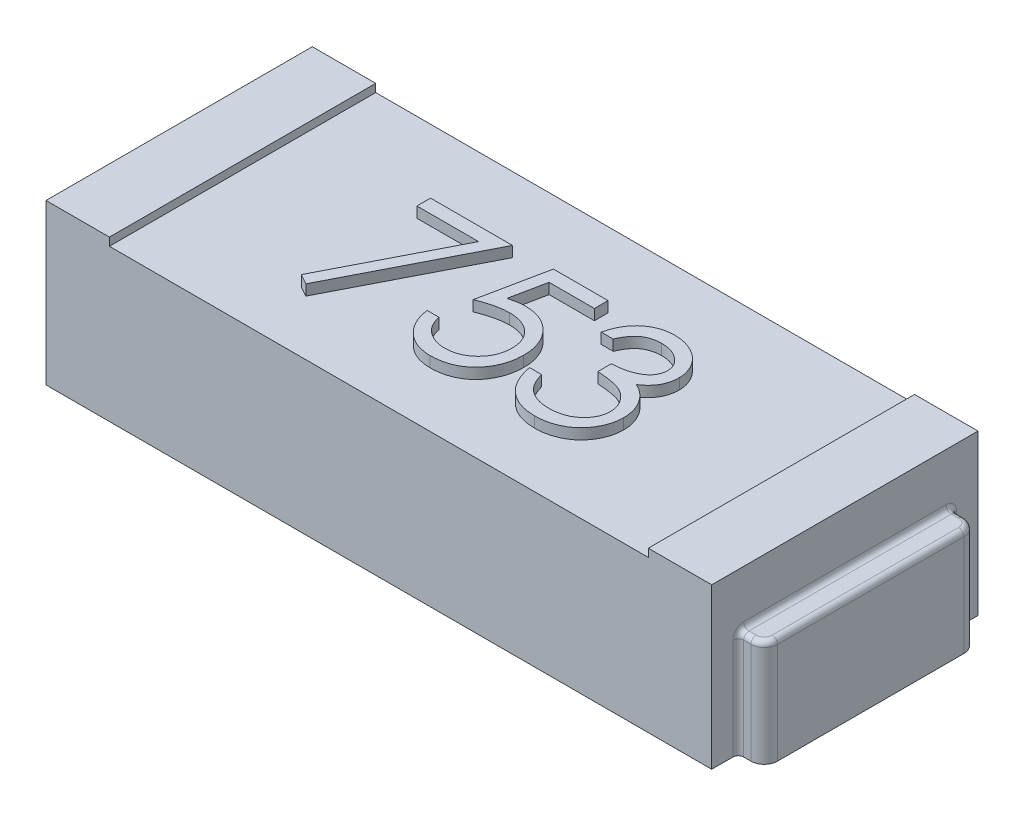
from build123d import *

# Parameters (mm, degrees)
ESQUISSE1_W             = 2.5
ESQUISSE1_H             = 1
BOSS_EXTRU_1_DEPTH      = 0.6
ESQUISSE2_W             = 2.023603034
ESQUISSE2_H             = 1
ENL_V_MAT_EXTRU_1_DEPTH = 0.03
BOSS_EXTRU_2_DEPTH      = 0.4
CONG_1_R                = 0.02
CONG_1_OF_SYM_TRIE2_R   = 0.02
BOSS_EXTRU_3_DEPTH      = 0.04


with BuildPart() as part:
    # Esquisse1 → Boss.-Extru.1 (new body)
    with BuildSketch(Plane(origin=(0, 0, 0), x_dir=(1, 0, 0), z_dir=(0, 1, 0))):
        Rectangle(ESQUISSE1_W, ESQUISSE1_H)
    extrude(amount=BOSS_EXTRU_1_DEPTH)

    # Esquisse2 → Enlèv. mat.-Extru.1 (cut)
    with BuildSketch(Plane(origin=(0, 0.6, 0), x_dir=(1, 0, 0), z_dir=(0, 1, 0))):
        Rectangle(ESQUISSE2_W, ESQUISSE2_H)
    extrude(amount=-ENL_V_MAT_EXTRU_1_DEPTH, mode=Mode.SUBTRACT)

    # Esquisse3 → Boss.-Extru.2 (add)
    with BuildSketch(Plane(origin=(0, 0, 0), x_dir=(1, 0, 0), z_dir=(0, 1, 0))):
        with BuildLine():
            Line((1.25, 0.4), (1.297141448, 0.4))
            ThreePointArc((1.297141448, 0.4), (1.332496787, 0.385355339), (1.347141448, 0.35))
            Line((1.347141448, 0.35), (1.347141448, -0.35))
            ThreePointArc((1.347141448, -0.35), (1.332496787, -0.385355339), (1.297141448, -0.4))
            Line((1.297141448, -0.4), (1.25, -0.4))
            Line((1.25, -0.4), (1.25, 0.4))
        make_face()
    boss_extru_2 = extrude(amount=BOSS_EXTRU_2_DEPTH)

    # Congé1
    cong_1_edges = [part.edges().sort_by_distance(p)[0] for p in [
        (1.25, 0.2, -0.4),
        (1.25, 0.2, 0.4),
        (1.25, 0.4, 0),
        (1.273570724, 0.4, 0.4),
        (1.332496787, 0.4, 0.385355339),
        (1.347141448, 0.4, 0),
        (1.332496787, 0.4, -0.385355339),
        (1.273570724, 0.4, -0.4),
    ]]
    fillet(cong_1_edges, radius=CONG_1_R)

    # Symétrie2: Boss.-Extru.2 across plane
    add(boss_extru_2.mirror(Plane(origin=(0, 0, 0), x_dir=(0, 0, 1), z_dir=(1, 0, 0))))

    # Congé1 of Symétrie2
    cong_1_of_sym_trie2_edges = [part.edges().sort_by_distance(p)[0] for p in [
        (-1.25, 0.2, -0.4),
        (-1.25, 0.2, 0.4),
        (-1.25, 0.4, 0),
        (-1.273570724, 0.4, 0.4),
        (-1.332496787, 0.4, 0.385355339),
        (-1.347141448, 0.4, 0),
        (-1.332496787, 0.4, -0.385355339),
        (-1.273570724, 0.4, -0.4),
    ]]
    fillet(cong_1_of_sym_trie2_edges, radius=CONG_1_OF_SYM_TRIE2_R)

    # Esquisse4 → Boss.-Extru.3 (add)
    with BuildSketch(Plane(origin=(0, 0.57, 0), x_dir=(1, 0, 0), z_dir=(0, 1, 0))):
        with BuildLine():
            Line((0.275641026, 0.104315862), (0.230769231, 0.104315862))
            add(Edge.make_bspline(
                [(0.230769231, 0.104315862), (0.231984881, 0.109349074), (0.234361377, 0.119188592), (0.239318174, 0.133246772), (0.244718067, 0.146550132), (0.251202225, 0.158849571), (0.258274904, 0.170392272), (0.26637815, 0.180916432), (0.27513811, 0.190689713), (0.284827389, 0.199363033), (0.294988626, 0.207216994), (0.305765001, 0.213913431), (0.3169397, 0.219674024), (0.328590147, 0.224419771), (0.340751029, 0.227994846), (0.353312404, 0.230588676), (0.366307189, 0.23227312), (0.375128274, 0.232437515), (0.379607372, 0.23252099)],
                knots=[0, 0, 0, 0, 1.162005537, 2.271625781, 3.343758855, 4.383309926, 5.390229558, 6.379919256, 7.361854164, 8.333198761, 9.295911338, 10.242430842, 11.177959212, 12.116337295, 13.062827104, 14.020064771, 14.994644689, 16, 16, 16, 16], degree=3))
            add(Edge.make_bspline(
                [(0.379607372, 0.23252099), (0.386133478, 0.232323957), (0.399043337, 0.231934189), (0.418009486, 0.228374984), (0.436299032, 0.222742822), (0.453711781, 0.214960861), (0.469885843, 0.205362674), (0.484276727, 0.19393914), (0.496689371, 0.180910668), (0.507102854, 0.166520302), (0.515256425, 0.151140943), (0.521268764, 0.13531235), (0.524929004, 0.119072068), (0.52540337, 0.108106742), (0.525641026, 0.102613138)],
                knots=[0, 0, 0, 0, 1.083050992, 2.142477498, 3.193116406, 4.255571735, 5.30263384, 6.308962982, 7.297363603, 8.282367274, 9.249857812, 10.179914175, 11.08814088, 12, 12, 12, 12], degree=3))
            add(Edge.make_bspline(
                [(0.525641026, 0.102613138), (0.525474798, 0.097326453), (0.525149517, 0.086981231), (0.522387559, 0.07187816), (0.517739522, 0.057643645), (0.511300984, 0.044217765), (0.502966477, 0.031685645), (0.492870378, 0.020019089), (0.480941426, 0.009166352), (0.471901578, 0.002949285), (0.467247596, -0.000251446)],
                knots=[0, 0, 0, 0, 1.024540389, 2.004866551, 2.965041327, 3.920577974, 4.882998113, 5.874504559, 6.905732034, 8, 8, 8, 8], degree=3))
            add(Edge.make_bspline(
                [(0.467247596, -0.000251446), (0.472566418, -0.002819756), (0.483104543, -0.007908321), (0.497468904, -0.017887715), (0.510508601, -0.029410051), (0.517780561, -0.038401858), (0.521434295, -0.042919715)],
                knots=[0, 0, 0, 0, 1.015518401, 2.012035669, 3.001164323, 4, 4, 4, 4], degree=3))
            add(Edge.make_bspline(
                [(0.521434295, -0.042919715), (0.523840201, -0.046213679), (0.528612615, -0.052747668), (0.534503405, -0.063252871), (0.539847564, -0.073874513), (0.544011881, -0.084897285), (0.54723672, -0.09619343), (0.549541867, -0.107782343), (0.550973887, -0.119673489), (0.551178966, -0.127718129), (0.551282051, -0.131761862)],
                knots=[0, 0, 0, 0, 1.025084078, 2.033381695, 3.024893161, 4.013698104, 4.991890475, 5.976764909, 6.982997093, 8, 8, 8, 8], degree=3))
            add(Edge.make_bspline(
                [(0.551282051, -0.131761862), (0.551025692, -0.138763251), (0.55051418, -0.15273308), (0.54594217, -0.173372326), (0.538854564, -0.193547398), (0.528789287, -0.212843803), (0.516522501, -0.230898143), (0.501928597, -0.247051902), (0.485173396, -0.260937417), (0.466486875, -0.272538878), (0.446241571, -0.281812867), (0.424587915, -0.288249644), (0.401837907, -0.29244193), (0.386236864, -0.292891483), (0.378305288, -0.293120035)],
                knots=[0, 0, 0, 0, 0.955779014, 1.907060117, 2.875433937, 3.871313158, 4.872415639, 5.851225146, 6.836215519, 7.83643374, 8.849228613, 9.86973379, 10.916971861, 12, 12, 12, 12], degree=3))
            add(Edge.make_bspline(
                [(0.378305288, -0.293120035), (0.372959674, -0.292996005), (0.362441288, -0.292751954), (0.346977931, -0.291083583), (0.332217688, -0.288036439), (0.318140603, -0.283935967), (0.304734169, -0.278737147), (0.292039297, -0.272263047), (0.279977883, -0.264647118), (0.268663747, -0.255799463), (0.258098238, -0.245902128), (0.248562134, -0.234779413), (0.23989645, -0.222636926), (0.232333215, -0.209333633), (0.225527937, -0.195041453), (0.219930657, -0.179577382), (0.215004147, -0.163079664), (0.212713652, -0.151582844), (0.211538462, -0.145684138)],
                knots=[0, 0, 0, 0, 1.048658725, 2.063410685, 3.046034179, 4.001477787, 4.936774919, 5.862367409, 6.792675028, 7.730719943, 8.675894397, 9.627829632, 10.600096036, 11.597688215, 12.626045268, 13.701542398, 14.82072376, 16, 16, 16, 16], degree=3))
            Line((0.211538462, -0.145684138), (0.256410256, -0.145684138))
            add(Edge.make_bspline(
                [(0.256410256, -0.145684138), (0.257579298, -0.149533997), (0.259853186, -0.157022307), (0.2637238, -0.167799494), (0.268133553, -0.177679216), (0.272864204, -0.186733947), (0.277832553, -0.195052862), (0.283391828, -0.202415986), (0.289130278, -0.209146729), (0.2934559, -0.212938817), (0.295572917, -0.214794715)],
                knots=[0, 0, 0, 0, 1.198163088, 2.33053128, 3.407730985, 4.417276592, 5.372219308, 6.28897303, 7.162600585, 8, 8, 8, 8], degree=3))
            add(Edge.make_bspline(
                [(0.295572917, -0.214794715), (0.298372428, -0.216953048), (0.303962808, -0.221263053), (0.313072555, -0.226763286), (0.322653253, -0.231529146), (0.332912492, -0.235169674), (0.343628888, -0.238252197), (0.354975655, -0.240269414), (0.366852686, -0.241653439), (0.374962366, -0.241775572), (0.379106571, -0.241837984)],
                knots=[0, 0, 0, 0, 0.946170439, 1.889420265, 2.845303464, 3.807233317, 4.801018734, 5.828864929, 6.890507805, 8, 8, 8, 8], degree=3))
            add(Edge.make_bspline(
                [(0.379106571, -0.241837984), (0.383785642, -0.241749998), (0.392935163, -0.241577948), (0.406285857, -0.239995704), (0.418986921, -0.237691359), (0.430897339, -0.234132362), (0.442173126, -0.229735097), (0.452656219, -0.224213896), (0.462484234, -0.217736079), (0.471531292, -0.210373342), (0.479666365, -0.202313128), (0.486829152, -0.19388269), (0.49291839, -0.185117571), (0.497830329, -0.175969268), (0.501708979, -0.166475664), (0.504349437, -0.156610117), (0.506185367, -0.146453365), (0.506334883, -0.139549226), (0.506410256, -0.136068753)],
                knots=[0, 0, 0, 0, 1.217147791, 2.380027433, 3.494444702, 4.572153297, 5.609568379, 6.639424714, 7.649109417, 8.668170816, 9.669597737, 10.625200337, 11.543417969, 12.441394052, 13.322311151, 14.205496177, 15.095365482, 16, 16, 16, 16], degree=3))
            add(Edge.make_bspline(
                [(0.506410256, -0.136068753), (0.506191642, -0.131409991), (0.505755501, -0.122115647), (0.502425704, -0.108441707), (0.496948723, -0.095266934), (0.489281221, -0.082816107), (0.479947546, -0.071276693), (0.469038273, -0.060980767), (0.456462812, -0.052485039), (0.444888545, -0.046615231), (0.43463638, -0.042609935), (0.425862754, -0.039942083), (0.416040382, -0.037682989), (0.405288046, -0.035581236), (0.39352473, -0.033792472), (0.380763238, -0.032300784), (0.367000987, -0.031107207), (0.357473677, -0.030574193), (0.352564103, -0.030299523)],
                knots=[0, 0, 0, 0, 1.07054697, 2.135767047, 3.216561865, 4.33974944, 5.486079747, 6.621378074, 7.775625952, 8.963672916, 9.598146892, 10.304877434, 11.070270905, 11.915000392, 12.823868403, 13.805723172, 14.86925407, 16, 16, 16, 16], degree=3))
            Line((0.352564103, -0.030299523), (0.352564103, 0.020982529))
            add(Edge.make_bspline(
                [(0.352564103, 0.020982529), (0.358749983, 0.021087501), (0.370866604, 0.021293115), (0.388565791, 0.023779974), (0.40549055, 0.027220063), (0.421265798, 0.032489376), (0.435644186, 0.038609419), (0.448118415, 0.045731163), (0.458513722, 0.053647556), (0.466779589, 0.062480786), (0.47299805, 0.071954364), (0.477544736, 0.081828172), (0.480230497, 0.092188752), (0.48058902, 0.099259419), (0.480769231, 0.102813458)],
                knots=[0, 0, 0, 0, 1.321986639, 2.589447074, 3.816329219, 5.01088745, 6.139805852, 7.153945165, 8.075214402, 8.924034688, 9.728124013, 10.488707548, 11.240355623, 12, 12, 12, 12], degree=3))
            add(Edge.make_bspline(
                [(0.480769231, 0.102813458), (0.480710029, 0.105424565), (0.48059225, 0.110619237), (0.479106925, 0.118208533), (0.476874919, 0.125565811), (0.473806386, 0.132659783), (0.469699215, 0.139441251), (0.464784074, 0.14596803), (0.458931489, 0.152202855), (0.452224996, 0.158014329), (0.44502331, 0.163552792), (0.437130485, 0.16825474), (0.428784503, 0.172275463), (0.419976123, 0.175591106), (0.410676762, 0.17808529), (0.400930111, 0.179876125), (0.390717585, 0.18099579), (0.383750194, 0.181156992), (0.380208333, 0.181238939)],
                knots=[0, 0, 0, 0, 0.884392785, 1.759457502, 2.611959086, 3.489218968, 4.37281399, 5.2945488, 6.255912374, 7.266815255, 8.301784654, 9.332968512, 10.37626691, 11.440494194, 12.520033166, 13.637162961, 14.798855837, 16, 16, 16, 16], degree=3))
            add(Edge.make_bspline(
                [(0.380208333, 0.181238939), (0.374515238, 0.181040173), (0.363395298, 0.180651937), (0.347364596, 0.177251506), (0.332461834, 0.171826066), (0.321070596, 0.16534992), (0.3126588, 0.158957001), (0.306647808, 0.153373803), (0.300744878, 0.147169114), (0.295338353, 0.139960774), (0.289870642, 0.132236947), (0.284892848, 0.123604993), (0.280055749, 0.114290079), (0.277141099, 0.107704989), (0.275641026, 0.104315862)],
                knots=[0, 0, 0, 0, 1.472543308, 2.876219568, 4.221790263, 5.565193594, 6.249813518, 6.953379497, 7.687249741, 8.463570142, 9.283606569, 10.136032583, 11.040678096, 12, 12, 12, 12], degree=3))
        make_face()
        with BuildLine():
            Line((0.141025641, 0.219700477), (0.141025641, 0.168418426))
            Line((0.141025641, 0.168418426), (-0.029046474, 0.168418426))
            Line((-0.029046474, 0.168418426), (-0.055989583, 0.036908009))
            add(Edge.make_bspline(
                [(-0.055989583, 0.036908009), (-0.050695887, 0.038369477), (-0.040440188, 0.041200839), (-0.025303065, 0.04434452), (-0.01093275, 0.046239584), (-0.001607697, 0.046498342), (0.002904647, 0.046623554)],
                knots=[0, 0, 0, 0, 1.100273476, 2.13160584, 3.095893838, 4, 4, 4, 4], degree=3))
            add(Edge.make_bspline(
                [(0.002904647, 0.046623554), (0.008488039, 0.046502706), (0.019466381, 0.046265089), (0.035529088, 0.043983396), (0.050862358, 0.04039198), (0.065434126, 0.035374763), (0.079271347, 0.028959086), (0.092246713, 0.020944809), (0.104554986, 0.011582905), (0.115975357, 0.000819332), (0.126335972, -0.011026614), (0.135445399, -0.023763452), (0.143182912, -0.037267404), (0.149405877, -0.051667491), (0.154375068, -0.066804513), (0.157682496, -0.082837739), (0.159884883, -0.099616042), (0.160130938, -0.111088123), (0.16025641, -0.116938144)],
                knots=[0, 0, 0, 0, 1.052922333, 2.070308379, 3.05430497, 4.020497103, 4.973039431, 5.925935799, 6.892292201, 7.88610001, 8.88166317, 9.857072816, 10.836096531, 11.812156883, 12.81219415, 13.836441305, 14.89672472, 16, 16, 16, 16], degree=3))
            add(Edge.make_bspline(
                [(0.16025641, -0.116938144), (0.1601614, -0.121012747), (0.159972662, -0.129106888), (0.159012864, -0.141127489), (0.157164904, -0.152893608), (0.154683801, -0.164406806), (0.151463455, -0.175645288), (0.147565019, -0.186641221), (0.142794158, -0.197326164), (0.137561104, -0.207801221), (0.13166875, -0.217829579), (0.125128964, -0.227208006), (0.118219608, -0.236077189), (0.110785124, -0.244342008), (0.102756411, -0.251948153), (0.094230701, -0.258940765), (0.085276027, -0.265438098), (0.075753849, -0.271176411), (0.065876352, -0.276456834), (0.055500892, -0.280788768), (0.044863649, -0.2846617), (0.033811524, -0.287748776), (0.022369551, -0.290167712), (0.010518869, -0.291810655), (-0.00167837, -0.293007289), (-0.009946229, -0.293082197), (-0.014122596, -0.293120035)],
                knots=[0, 0, 0, 0, 1.056347294, 2.098418968, 3.122841568, 4.141288669, 5.149314143, 6.15115421, 7.162517403, 8.180376062, 9.185164535, 10.17417709, 11.141909838, 12.097768115, 13.052685741, 14.0056014, 14.954263652, 15.917497458, 16.885230207, 17.854509472, 18.828990115, 19.81800267, 20.826176721, 21.857883937, 22.917946725, 24, 24, 24, 24], degree=3))
            add(Edge.make_bspline(
                [(-0.014122596, -0.293120035), (-0.019104622, -0.293021344), (-0.028906169, -0.292827181), (-0.04326625, -0.290795969), (-0.057082622, -0.287886838), (-0.070244065, -0.283510228), (-0.082868532, -0.278026329), (-0.094786063, -0.271095447), (-0.106301174, -0.26324129), (-0.11694575, -0.253972668), (-0.126825195, -0.243841856), (-0.135668982, -0.232847907), (-0.143545207, -0.221172273), (-0.150327743, -0.208758251), (-0.156113174, -0.19563846), (-0.160658173, -0.181763746), (-0.164326509, -0.167206603), (-0.165878426, -0.157184673), (-0.166666667, -0.152094394)],
                knots=[0, 0, 0, 0, 1.0467383, 2.05933395, 3.04377827, 4.011590433, 4.970194871, 5.932262533, 6.905835911, 7.896367577, 8.894135286, 9.877477877, 10.858688626, 11.851381753, 12.8477658, 13.868841284, 14.917554742, 16, 16, 16, 16], degree=3))
            Line((-0.166666667, -0.152094394), (-0.121794872, -0.152094394))
            add(Edge.make_bspline(
                [(-0.121794872, -0.152094394), (-0.120690792, -0.156862459), (-0.11856869, -0.166026944), (-0.113910726, -0.17890285), (-0.108215601, -0.190377025), (-0.101443551, -0.200601251), (-0.093364975, -0.209516822), (-0.084146485, -0.217462117), (-0.073811096, -0.224629992), (-0.062326349, -0.230604673), (-0.050210195, -0.235700209), (-0.037529165, -0.239093309), (-0.024628544, -0.24147915), (-0.015903063, -0.241717973), (-0.011518429, -0.241837984)],
                knots=[0, 0, 0, 0, 1.136247022, 2.183929868, 3.172523383, 4.106158343, 5.02341133, 5.958108904, 6.928429099, 7.938127109, 8.96079061, 9.975095812, 10.982467395, 12, 12, 12, 12], degree=3))
            add(Edge.make_bspline(
                [(-0.011518429, -0.241837984), (-0.007238652, -0.24172073), (0.001188266, -0.241489856), (0.013589892, -0.239712854), (0.02556316, -0.236976058), (0.036989925, -0.232880365), (0.048070145, -0.227902548), (0.058523541, -0.22151468), (0.068652524, -0.214163249), (0.078142257, -0.205740873), (0.086833607, -0.196459488), (0.094513053, -0.186534146), (0.100909755, -0.175946025), (0.106300342, -0.164878432), (0.11039367, -0.153210067), (0.11331381, -0.140995613), (0.115028533, -0.128204902), (0.115264416, -0.119480715), (0.115384615, -0.1150351)],
                knots=[0, 0, 0, 0, 1.027316725, 2.022795036, 3.002884548, 3.971462791, 4.93288096, 5.914575861, 6.907176829, 7.935150275, 8.956128384, 9.956726525, 10.942570165, 11.921478529, 12.907843606, 13.90538589, 14.932640048, 16, 16, 16, 16], degree=3))
            add(Edge.make_bspline(
                [(0.115384615, -0.1150351), (0.115290547, -0.111024278), (0.115106421, -0.103173665), (0.113602054, -0.091688064), (0.110985344, -0.080820487), (0.107353361, -0.070518453), (0.102742003, -0.060772247), (0.097106815, -0.05157181), (0.090342044, -0.043038405), (0.082614631, -0.035168041), (0.074149197, -0.027904487), (0.064800091, -0.021712475), (0.054762958, -0.016503344), (0.04415873, -0.012007915), (0.032735173, -0.008779237), (0.020718511, -0.006355254), (0.007978981, -0.004953059), (-0.000731117, -0.004758504), (-0.005208333, -0.004658497)],
                knots=[0, 0, 0, 0, 1.045622112, 2.046656509, 3.013763289, 3.955457236, 4.890082067, 5.820317437, 6.762574623, 7.722996705, 8.69280354, 9.665887285, 10.63943826, 11.638615906, 12.663482002, 13.728887084, 14.832589034, 16, 16, 16, 16], degree=3))
            add(Edge.make_bspline(
                [(-0.005208333, -0.004658497), (-0.009083895, -0.004741439), (-0.017085945, -0.004912692), (-0.029360635, -0.00617362), (-0.042259452, -0.008207805), (-0.055732952, -0.01100584), (-0.069821596, -0.014667423), (-0.084495653, -0.019055209), (-0.099785977, -0.024301208), (-0.110088509, -0.028262953), (-0.115384615, -0.030299523)],
                knots=[0, 0, 0, 0, 0.817624296, 1.688186739, 2.600797293, 3.572016777, 4.590301741, 5.671205678, 6.80286297, 8, 8, 8, 8], degree=3))
            Line((-0.115384615, -0.030299523), (-0.064102564, 0.219700477))
            Line((-0.064102564, 0.219700477), (0.141025641, 0.219700477))
        make_face()
        Polygon((-0.525641026, 0.219700477), (-0.217948718, 0.219700477), (-0.480769231, -0.293120035), (-0.51953125, -0.271785901), (-0.293870192, 0.168418426), (-0.525641026, 0.168418426), align=None)
    extrude(amount=BOSS_EXTRU_3_DEPTH)


solid = part.part
